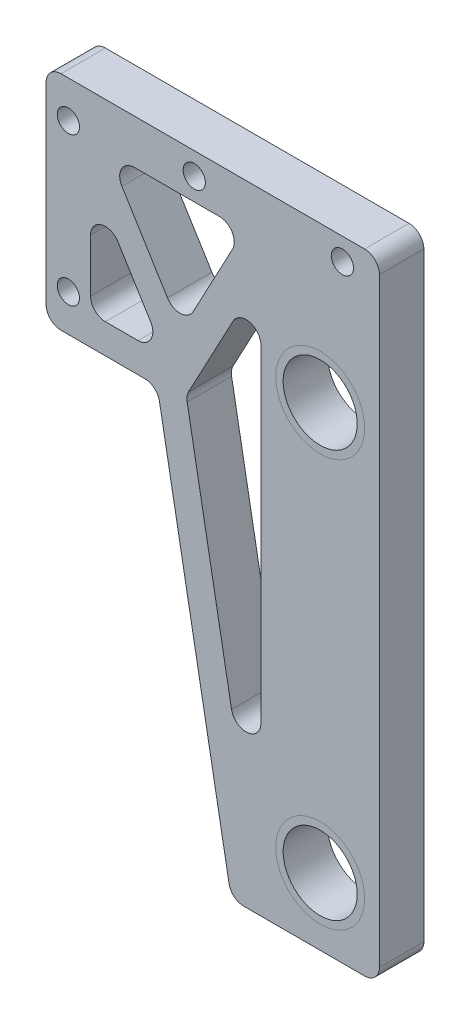
from build123d import *

# Parameters (mm, degrees)
SKETCH_1_R          = 6
SKETCH_1_R_2        = 1.5
EXTRUDE_1_DEPTH     = 6
SKETCH_2_R          = 6
SKETCH_2_R_2        = 5
EXTRUDE_2_DEPTH     = 6
EXTRUDE_2_2_DEPTH   = 6
CUT_EXTRUDE_1_DEPTH = 6
FILLET_2_R          = 2
SKETCH_4_R          = 8
SKETCH_4_R_2        = 5
EXTRUDE_3_DEPTH     = 0.5
EXTRUDE_3_2_DEPTH   = 0.5
SKETCH_5_R          = 8
SKETCH_5_R_2        = 5
EXTRUDE_4_DEPTH     = 0.5
EXTRUDE_4_2_DEPTH   = 0.5


with BuildPart() as part:
    # 草图1 → 凸台-拉伸1 (new body)
    with BuildSketch(Plane.XY):
        Polygon((-37, 20.95), (8, 20.95), (8, -64.05), (-12, -64.05), (-22, -9.05), (-37, -9.05), align=None)
        Circle(SKETCH_1_R, mode=Mode.SUBTRACT)
        with Locations((0, -55)):
            Circle(SKETCH_1_R, mode=Mode.SUBTRACT)
        with Locations((3, 17.95)):
            Circle(SKETCH_1_R_2, mode=Mode.SUBTRACT)
        with Locations((-17, 17.95)):
            Circle(SKETCH_1_R_2, mode=Mode.SUBTRACT)
        with Locations((-34, 15.95)):
            Circle(SKETCH_1_R_2, mode=Mode.SUBTRACT)
        with Locations((-34, -4.05)):
            Circle(SKETCH_1_R_2, mode=Mode.SUBTRACT)
    extrude(amount=EXTRUDE_1_DEPTH)

    # 草图3 → 切除-拉伸1 (cut)
    with BuildSketch(Plane.XY.offset(6)):
        Polygon((-8, -63.689320225), (-8, 10.698456851), (-18.085282501, -8.220266471), align=None)
        Polygon((-18.788186972, -1.035740679), (-10.266432729, 14.95), (-28.65003451, 14.95), align=None)
        Polygon((-31, -5.05), (-21.011660076, -5.05), (-31, 11.140780806), align=None)
    extrude(amount=-CUT_EXTRUDE_1_DEPTH, mode=Mode.SUBTRACT)

    # 圆角2
    fillet_2_edges = [part.edges().sort_by_distance(p)[0] for p in [
        (8, -64.05, 3),
        (-12, -64.05, 3),
        (-22, -9.05, 3),
        (-37, -9.05, 3),
        (-37, 20.95, 3),
        (8, 20.95, 3),
        (-10.266432729, 14.95, 3),
        (-28.65003451, 14.95, 3),
        (-18.788186972, -1.035740679, 3),
        (-31, 11.140780806, 3),
        (-21.011660076, -5.05, 3),
        (-31, -5.05, 3),
        (-18.085282501, -8.220266471, 3),
        (-8, -63.689320225, 3),
        (-8, 10.698456851, 3),
    ]]
    fillet(fillet_2_edges, radius=FILLET_2_R)


with BuildPart() as body_2:
    # 草图2 → 凸台-拉伸2 (new body)
    with BuildSketch(Plane.XY.offset(6)):
        with Locations((0, -55)):
            Circle(SKETCH_2_R)
        with Locations((0, -55)):
            Circle(SKETCH_2_R_2, mode=Mode.SUBTRACT)
    extrude(amount=-EXTRUDE_2_DEPTH)


with BuildPart() as body_3:
    # 草图2 → Extrude 2 2 (new body)
    with BuildSketch(Plane.XY.offset(6)):
        Circle(SKETCH_2_R)
        Circle(SKETCH_2_R_2, mode=Mode.SUBTRACT)
    extrude(amount=-EXTRUDE_2_2_DEPTH)


with BuildPart() as body_4:
    # 草图4 → 凸台-拉伸3 (new body)
    with BuildSketch(Plane.XY.offset(6)):
        Circle(SKETCH_4_R)
        Circle(SKETCH_4_R_2, mode=Mode.SUBTRACT)
    extrude(amount=EXTRUDE_3_DEPTH)


with BuildPart() as body_5:
    # 草图4 → Extrude 3 2 (new body)
    with BuildSketch(Plane.XY.offset(6)):
        with Locations((0, -55)):
            Circle(SKETCH_4_R)
        with Locations((0, -55)):
            Circle(SKETCH_4_R_2, mode=Mode.SUBTRACT)
    extrude(amount=EXTRUDE_3_2_DEPTH)


with BuildPart() as body_6:
    # 草图5 → 凸台-拉伸4 (new body)
    with BuildSketch(Plane(origin=(0, 0, 0), x_dir=(-1, 0, 0), z_dir=(0, 0, -1))):
        with Locations((0, -55)):
            Circle(SKETCH_5_R)
        with Locations(Location((0, -55, 0), (0, 0, 180))):
            Circle(SKETCH_5_R_2, mode=Mode.SUBTRACT)
    extrude(amount=EXTRUDE_4_DEPTH)


with BuildPart() as body_7:
    # 草图5 → Extrude 4 2 (new body)
    with BuildSketch(Plane(origin=(0, 0, 0), x_dir=(-1, 0, 0), z_dir=(0, 0, -1))):
        Circle(SKETCH_5_R)
        with Locations(Location((0, 0, 0), (0, 0, 180))):
            Circle(SKETCH_5_R_2, mode=Mode.SUBTRACT)
    extrude(amount=EXTRUDE_4_2_DEPTH)


solid = Compound([part.part, body_2.part, body_3.part])
